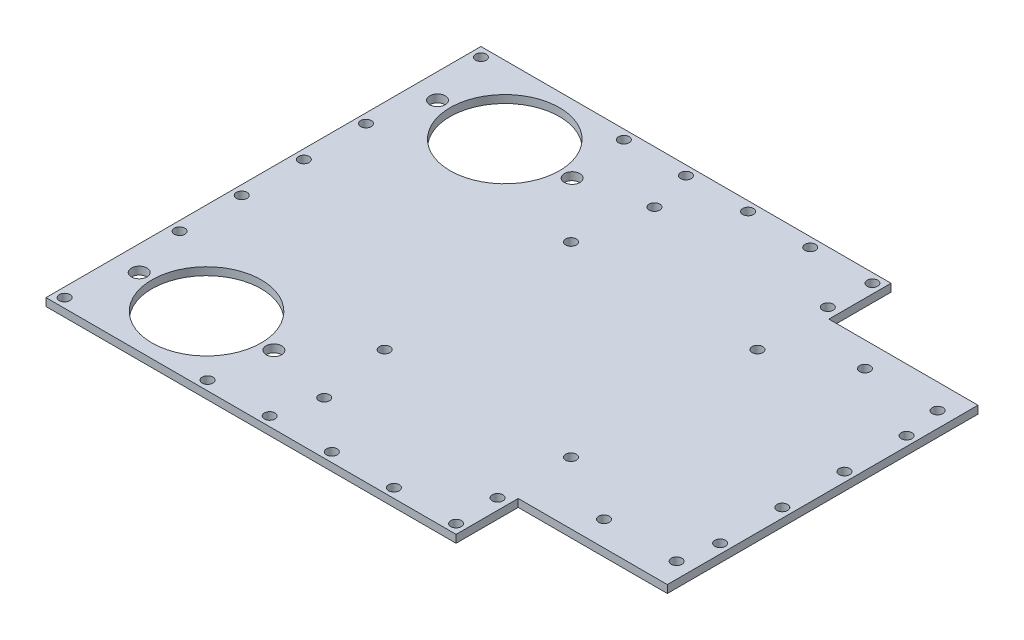
from build123d import *

# Parameters (mm, degrees)
SKETCH1_W           = 228.6
SKETCH1_H           = 177.8
BOSS_EXTRUDE1_DEPTH = 3.175
SKETCH2_R           = 2.1717
SKETCH2_R_2         = 3.175
SKETCH2_R_3         = 22.352
SKETCH2_R_4         = 2.159
SKETCH2_W           = 60.96
SKETCH2_H           = 25.4
CUT_EXTRUDE1_DEPTH  = 3.175


with BuildPart() as part:
    # Sketch1 → Boss-Extrude1 (new body)
    with BuildSketch(Plane(origin=(0, 0, 0), x_dir=(1, 0, 0), z_dir=(0, 1, 0))):
        with Locations((-103.587357149, -18.25946167)):
            Rectangle(SKETCH1_W, SKETCH1_H)
    extrude(amount=BOSS_EXTRUDE1_DEPTH)

    # Sketch2 → Cut-Extrude1 (cut)
    with BuildSketch(Plane(origin=(0, 3.175, 0), x_dir=(1, 0, 0), z_dir=(0, 1, 0))):
        with Locations(Location((4.362642851, 35.08053833, 0), (0, 0, 270))):
            Circle(SKETCH2_R)
        with Locations(Location((-25.355357149, 35.08053833, 0), (0, 0, 270))):
            Circle(SKETCH2_R)
        with Locations(Location((4.362642851, -71.59946167, 0), (0, 0, 270))):
            Circle(SKETCH2_R)
        with Locations(Location((-25.355357149, -71.59946167, 0), (0, 0, 270))):
            Circle(SKETCH2_R)
        with Locations(Location((-207.727357149, 42.70053833, 0), (0, 0, 270))):
            Circle(SKETCH2_R_2)
        with Locations(Location((-152.660157149, 42.70053833, 0), (0, 0, 270))):
            Circle(SKETCH2_R_2)
        with Locations(Location((-180.193757149, 42.70053833, 0), (0, 0, 270))):
            Circle(SKETCH2_R_3)
        with Locations(Location((-207.727357149, -79.21946167, 0), (0, 0, 270))):
            Circle(SKETCH2_R_2)
        with Locations(Location((-180.193757149, -79.21946167, 0), (0, 0, 270))):
            Circle(SKETCH2_R_3)
        with Locations(Location((-152.660157149, -79.21946167, 0), (0, 0, 270))):
            Circle(SKETCH2_R_2)
        with Locations(Location((-54.692357149, 49.24054303, 0), (0, 0, 270))):
            Circle(SKETCH2_R)
        with Locations(Location((-125.558357149, 49.24054303, 0), (0, 0, 270))):
            Circle(SKETCH2_R)
        with Locations(Location((-125.558357149, -85.75946637, 0), (0, 0, 270))):
            Circle(SKETCH2_R)
        with Locations(Location((-54.692357149, -85.75946637, 0), (0, 0, 270))):
            Circle(SKETCH2_R)
        with Locations(Location((-54.057357149, 66.83053833, 0), (0, 0, 270))):
            Circle(SKETCH2_R_4)
        with Locations(Location((-54.057357149, -103.34946167, 0), (0, 0, 270))):
            Circle(SKETCH2_R_4)
        with Locations(Location((-214.077357149, 66.83053833, 0), (0, 0, 270))):
            Circle(SKETCH2_R_4)
        with Locations(Location((-214.077357149, -103.34946167, 0), (0, 0, 270))):
            Circle(SKETCH2_R)
        with Locations(Location((-79.457357149, 66.83053833, 0), (0, 0, 270))):
            Circle(SKETCH2_R)
        with Locations(Location((-104.857357149, 66.83053833, 0), (0, 0, 270))):
            Circle(SKETCH2_R)
        with Locations(Location((-130.257357149, 66.83053833, 0), (0, 0, 270))):
            Circle(SKETCH2_R)
        with Locations(Location((-155.657357149, 66.83053833, 0), (0, 0, 270))):
            Circle(SKETCH2_R)
        with Locations(Location((-79.457357149, -103.34946167, 0), (0, 0, 270))):
            Circle(SKETCH2_R)
        with Locations(Location((-104.857357149, -103.34946167, 0), (0, 0, 270))):
            Circle(SKETCH2_R)
        with Locations(Location((-130.257357149, -103.34946167, 0), (0, 0, 270))):
            Circle(SKETCH2_R)
        with Locations(Location((-155.657357149, -103.34946167, 0), (0, 0, 270))):
            Circle(SKETCH2_R)
        with Locations(Location((-214.077357149, 19.84053833, 0), (0, 0, 270))):
            Circle(SKETCH2_R)
        with Locations(Location((-214.077357149, -5.55946167, 0), (0, 0, 270))):
            Circle(SKETCH2_R)
        with Locations(Location((-214.077357149, -30.95946167, 0), (0, 0, 270))):
            Circle(SKETCH2_R)
        with Locations(Location((-214.077357149, -56.35946167, 0), (0, 0, 270))):
            Circle(SKETCH2_R)
        with Locations(Location((-130.257357149, 19.84053833, 0), (0, 0, 270))):
            Circle(SKETCH2_R)
        with Locations(Location((-130.257357149, -56.35946167, 0), (0, 0, 270))):
            Circle(SKETCH2_R)
        with Locations(Location((6.902642851, 19.84053833, 0), (0, 0, 270))):
            Circle(SKETCH2_R)
        with Locations(Location((6.902642851, -5.55946167, 0), (0, 0, 270))):
            Circle(SKETCH2_R)
        with Locations(Location((6.902642851, -30.95946167, 0), (0, 0, 270))):
            Circle(SKETCH2_R)
        with Locations(Location((6.902642851, -56.35946167, 0), (0, 0, 270))):
            Circle(SKETCH2_R)
        with Locations(Location((-54.057357149, 19.84053833, 0), (0, 0, 270))):
            Circle(SKETCH2_R)
        with Locations(Location((-54.057357149, -56.35946167, 0), (0, 0, 270))):
            Circle(SKETCH2_R)
        with Locations((-19.767357149, -94.45946167)):
            Rectangle(SKETCH2_W, SKETCH2_H)
        with Locations((-19.767357149, 57.94053833)):
            Rectangle(SKETCH2_W, SKETCH2_H)
    extrude(amount=-CUT_EXTRUDE1_DEPTH, mode=Mode.SUBTRACT)


solid = part.part
